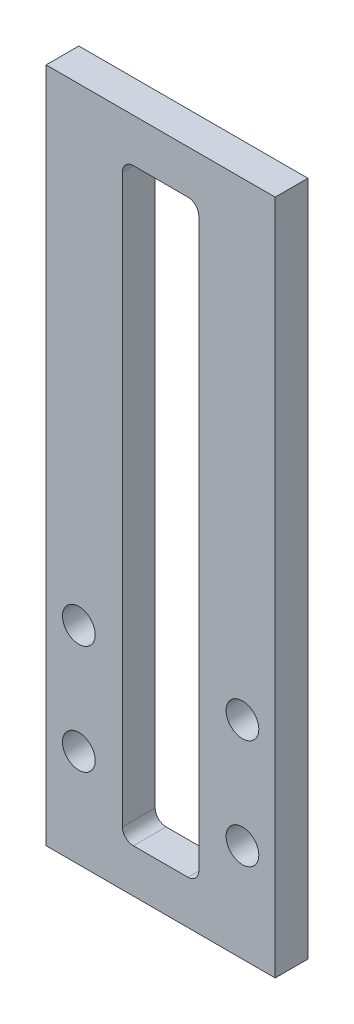
from build123d import *

# Parameters (mm, degrees)
SKETCH_1_R          = 1.5
EXTRUDE_1_DEPTH     = 3
FILLET_1_R          = 2
SKETCH_3_W          = 25.138692766
SKETCH_3_H          = 29.703861026
CUT_EXTRUDE_1_DEPTH = 38.353045391
SKETCH_4_W          = 21
SKETCH_4_H          = 34
EXTRUDE_2_DEPTH     = 3
SKETCH_5_W          = 7
SKETCH_5_H          = 54
CUT_EXTRUDE_2_DEPTH = 50.226517244
FILLET_2_R          = 1


with BuildPart() as part:
    # 草图1 → 凸台-拉伸1 (new body)
    with BuildSketch(Plane.XY):
        Polygon((-10.5, 14), (10.5, 14), (10.5, 4), (34.5, 4), (34.5, -4), (10.5, -4), (10.5, -14), (-10.5, -14), align=None)
        with Locations((-7.5, 5)):
            Circle(SKETCH_1_R, mode=Mode.SUBTRACT)
        with Locations((7.5, 5)):
            Circle(SKETCH_1_R, mode=Mode.SUBTRACT)
        with Locations((-7.5, -5)):
            Circle(SKETCH_1_R, mode=Mode.SUBTRACT)
        with Locations((7.5, -5)):
            Circle(SKETCH_1_R, mode=Mode.SUBTRACT)
        with Locations((16.5, 0)):
            Circle(SKETCH_1_R, mode=Mode.SUBTRACT)
        with Locations((31.5, 0)):
            Circle(SKETCH_1_R, mode=Mode.SUBTRACT)
    extrude(amount=EXTRUDE_1_DEPTH)

    # 圆角1
    fillet_1_edges = [part.edges().sort_by_distance(p)[0] for p in [
        (10.5, 4, 1.5),
        (10.5, -4, 1.5),
    ]]
    fillet(fillet_1_edges, radius=FILLET_1_R)

    # 草图3 → 切除-拉伸1 (cut, through all)
    with BuildSketch(Plane.XY.offset(3)):
        with Locations((23.069346383, -0.851930513)):
            Rectangle(SKETCH_3_W, SKETCH_3_H)
    extrude(amount=-CUT_EXTRUDE_1_DEPTH, mode=Mode.SUBTRACT)

    # 草图4 → 凸台-拉伸2 (add)
    with BuildSketch(Plane.XY.offset(3)):
        with Locations((0, 31)):
            Rectangle(SKETCH_4_W, SKETCH_4_H)
    extrude(amount=-EXTRUDE_2_DEPTH)

    # 草图5 → 切除-拉伸2 (cut, through all)
    with BuildSketch(Plane.XY.offset(3)):
        with Locations((0, 17)):
            Rectangle(SKETCH_5_W, SKETCH_5_H)
    extrude(amount=-CUT_EXTRUDE_2_DEPTH, mode=Mode.SUBTRACT)

    # 圆角2
    fillet_2_edges = [part.edges().sort_by_distance(p)[0] for p in [
        (-3.5, -10, 1.5),
        (-3.5, 44, 1.5),
        (3.5, 44, 1.5),
        (3.5, -10, 1.5),
    ]]
    fillet(fillet_2_edges, radius=FILLET_2_R)


solid = part.part
